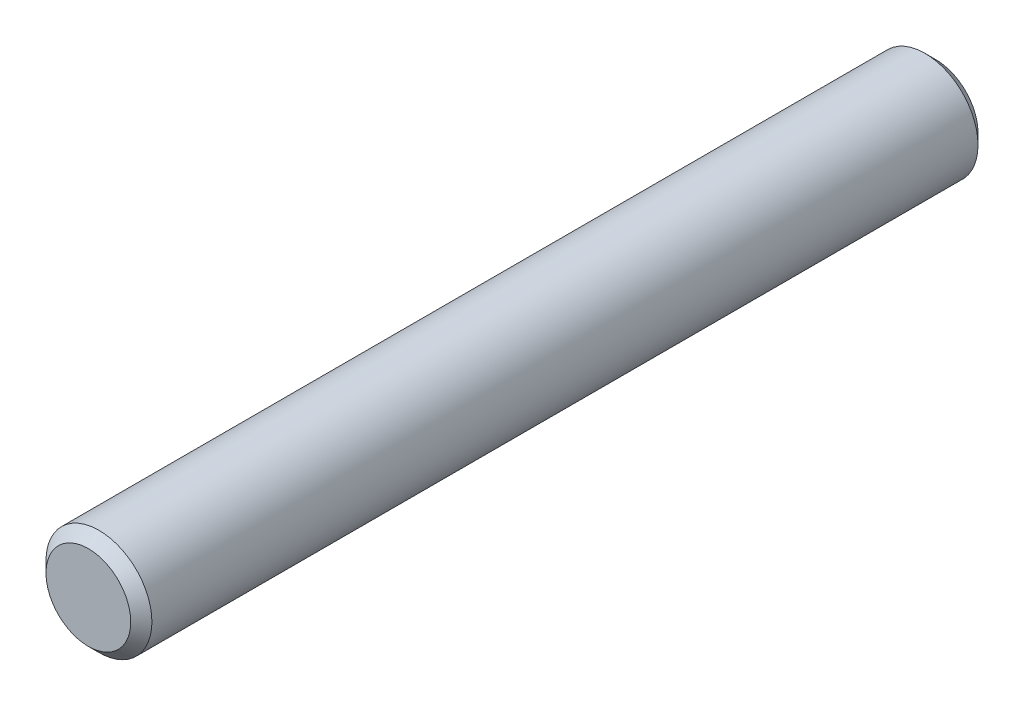
from build123d import *

# Parameters (mm, degrees)
SKETCH3_R           = 1.5875
BOSS_EXTRUDE1_DEPTH = 12.7
CHAMFER1_SIZE       = 0.3175


with BuildPart() as part:
    # Sketch3 → Boss-Extrude1 (new, symmetric)
    with BuildSketch(Plane.XY):
        Circle(SKETCH3_R)
    extrude(amount=BOSS_EXTRUDE1_DEPTH, both=True)

    # Chamfer1
    chamfer1_edges = [part.edges().sort_by_distance(p)[0] for p in [
        (-1.5875, 0, -12.7),
        (-1.5875, 0, 12.7),
    ]]
    chamfer(chamfer1_edges, length=CHAMFER1_SIZE)


solid = part.part
